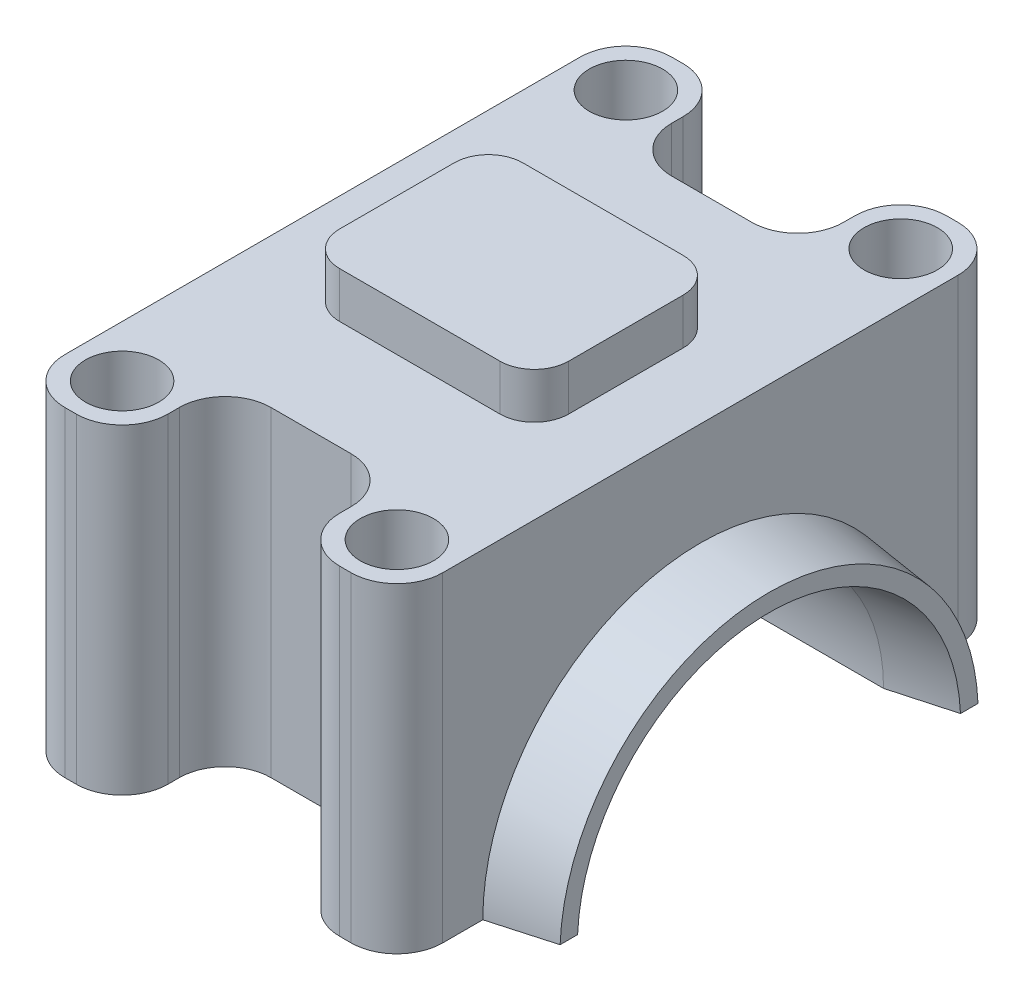
from build123d import *

# Parameters (mm, degrees)
BOSS_EXTRUDE1_DEPTH  = 14
CUT_EXTRUDE1_REACH   = 22.967
SKETCH2_R            = 1.6
FILLET2_R            = 2
FILLET2_OF_MIRROR1_R = 2
BOSS_EXTRUDE2_DEPTH  = 2
CUT_EXTRUDE2_REACH   = 28.529
BOSS_EXTRUDE3_DEPTH  = 3
BOSS_EXTRUDE3_DRAFT  = 7
BOSS_EXTRUDE4_DEPTH  = 1.5


with BuildPart() as part:
    # Sketch1 → Boss-Extrude1 (new body)
    with BuildSketch(Plane(origin=(0, 0, 0), x_dir=(1, 0, 0), z_dir=(0, 1, 0))):
        Polygon((-8.25, 0), (-8.25, 13.25), (-3.75, 13.25), (-3.75, 8.75), (3.75, 8.75), (3.75, 13.25), (8.25, 13.25), (8.25, 0), align=None)
    boss_extrude1 = extrude(amount=BOSS_EXTRUDE1_DEPTH)

    # Sketch2 → Cut-Extrude1 (cut, up to next)
    with BuildSketch(Plane(origin=(0, 14, 0), x_dir=(1, 0, 0), z_dir=(0, 1, 0)), mode=Mode.PRIVATE) as cut_extrude1_sk1:
        with Locations(Location((-6, 11, 0), (0, 0, 270))):
            Circle(SKETCH2_R)
    cut_extrude1_tool1 = extrude(cut_extrude1_sk1.sketch, amount=-CUT_EXTRUDE1_REACH, mode=Mode.PRIVATE) & part.part
    # Sketch2 → Cut-Extrude1 (cut, up to next)
    with BuildSketch(Plane(origin=(0, 14, 0), x_dir=(1, 0, 0), z_dir=(0, 1, 0)), mode=Mode.PRIVATE) as cut_extrude1_sk2:
        with Locations(Location((6, 11, 0), (0, 0, 270))):
            Circle(SKETCH2_R)
    cut_extrude1_tool2 = extrude(cut_extrude1_sk2.sketch, amount=-CUT_EXTRUDE1_REACH, mode=Mode.PRIVATE) & part.part
    cut_extrude1_1 = cut_extrude1_tool1.solids().sort_by_distance((-6, 14, -11))[0]
    add(cut_extrude1_1, mode=Mode.SUBTRACT)
    cut_extrude1_2 = cut_extrude1_tool2.solids().sort_by_distance((6, 14, -11))[0]
    add(cut_extrude1_2, mode=Mode.SUBTRACT)
    cut_extrude1 = cut_extrude1_1 + cut_extrude1_2  # Cut-Extrude1 as one shape, for the pattern or mirror that repeats it

    # Fillet2
    fillet2_edges = [part.edges().sort_by_distance(p)[0] for p in [
        (-8.25, 7, -13.25),
        (-3.75, 7, -13.25),
        (-3.75, 7, -8.75),
        (3.75, 7, -8.75),
        (3.75, 7, -13.25),
        (8.25, 7, -13.25),
    ]]
    fillet(fillet2_edges, radius=FILLET2_R)

    # Mirror1: Boss-Extrude1, Cut-Extrude1 across plane
    add(boss_extrude1.mirror(Plane.XY))
    add(cut_extrude1.mirror(Plane.XY), mode=Mode.SUBTRACT)

    # Fillet2 of Mirror1
    fillet2_of_mirror1_edges = [part.edges().sort_by_distance(p)[0] for p in [
        (-8.25, 7, 13.25),
        (-3.75, 7, 13.25),
        (-3.75, 7, 8.75),
        (3.75, 7, 8.75),
        (3.75, 7, 13.25),
        (8.25, 7, 13.25),
    ]]
    fillet(fillet2_of_mirror1_edges, radius=FILLET2_OF_MIRROR1_R)

    # Sketch3 → Boss-Extrude2 (add)
    with BuildSketch(Plane(origin=(0, 14, 0), x_dir=(1, 0, 0), z_dir=(0, 1, 0))):
        with BuildLine():
            Line((-3.5, -4), (3.5, -4))
            ThreePointArc((3.5, -4), (4.560660172, -3.560660172), (5, -2.5))
            Line((5, -2.5), (5, 2.5))
            ThreePointArc((5, 2.5), (4.560660172, 3.560660172), (3.5, 4))
            Line((3.5, 4), (-3.5, 4))
            ThreePointArc((-3.5, 4), (-4.560660172, 3.560660172), (-5, 2.5))
            Line((-5, 2.5), (-5, -2.5))
            ThreePointArc((-5, -2.5), (-4.560660172, -3.560660172), (-3.5, -4))
        make_face()
    extrude(amount=BOSS_EXTRUDE2_DEPTH)

    # Sketch4 → Cut-Extrude2 (cut, up to next)
    with BuildSketch(Plane(origin=(8.25, 0, 0), x_dir=(0, 0, -1), z_dir=(1, 0, 0)), mode=Mode.PRIVATE) as cut_extrude2_sk1:
        with BuildLine():
            Line((-8, 0), (8, 0))
            ThreePointArc((8, 0), (0, 8), (-8, 0))
        make_face()
    cut_extrude2_tool1 = extrude(cut_extrude2_sk1.sketch, amount=-CUT_EXTRUDE2_REACH, mode=Mode.PRIVATE) & part.part
    add(cut_extrude2_tool1.solids().sort_by_distance((8.25, 3.395305, 0))[0], mode=Mode.SUBTRACT)


with BuildPart() as boss_extrude3_tool:
    # Sketch5 → Boss-Extrude3 (with draft: the straight prism first)
    with BuildSketch(Plane(origin=(8.25, 0, 0), x_dir=(0, 0, -1), z_dir=(1, 0, 0))):
        with BuildLine():
            Line((-9.5, 0), (-8, 0))
            ThreePointArc((-8, 0), (0, 8), (8, 0))
            Line((8, 0), (9.5, 0))
            ThreePointArc((9.5, 0), (0, 9.5), (-9.5, 0))
        make_face()
    extrude(amount=BOSS_EXTRUDE3_DEPTH)
    # Boss-Extrude3: the draft: its side faces are tilted about the plane it starts from
    boss_extrude3_sides = [boss_extrude3_tool.faces().sort_by_distance(p)[0] for p in [
        (9.75, 0, 8.75),
        (9.75, 8, 0),
        (9.75, 0, -8.75),
        (9.75, 9.5, 0),
    ]]
    draft(boss_extrude3_sides, Plane(origin=(8.25, 0, 0), x_dir=(0, 0, -1), z_dir=(1, 0, 0)), BOSS_EXTRUDE3_DRAFT)


with BuildPart() as part_1:
    add(part.part)

    # Boss-Extrude3: add boss_extrude3_tool
    add(boss_extrude3_tool.part)

    # Sketch6 → Boss-Extrude4 (add)
    with BuildSketch(Plane.ZY.offset(8.25)):
        with BuildLine():
            Line((-9.5, 0), (-8, 0))
            ThreePointArc((-8, 0), (0, 8), (8, 0))
            Line((8, 0), (9.5, 0))
            ThreePointArc((9.5, 0), (0, 9.5), (-9.5, 0))
        make_face()
    extrude(amount=BOSS_EXTRUDE4_DEPTH)


solid = part_1.part
